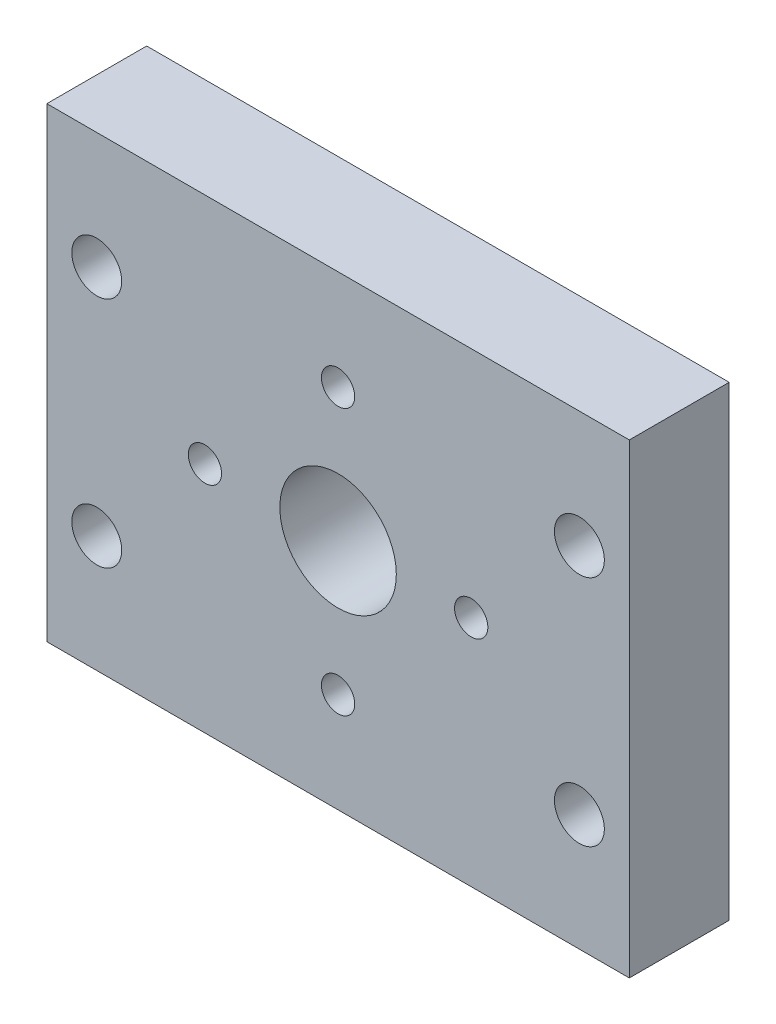
from build123d import *

# Parameters (mm, degrees)
ESQUISSE1_W        = 35
ESQUISSE1_H        = 28
ESQUISSE1_R        = 3.5
ESQUISSE1_R_2      = 1
ESQUISSE1_R_3      = 1.5
BOSS_EXTRU_1_DEPTH = 6


with BuildPart() as part:
    # Esquisse1 → Boss.-Extru.1 (new body)
    with BuildSketch(Plane.XY):
        Rectangle(ESQUISSE1_W, ESQUISSE1_H)
        Circle(ESQUISSE1_R, mode=Mode.SUBTRACT)
        with Locations((0, 8)):
            Circle(ESQUISSE1_R_2, mode=Mode.SUBTRACT)
        with Locations((8, 0)):
            Circle(ESQUISSE1_R_2, mode=Mode.SUBTRACT)
        with Locations((0, -8)):
            Circle(ESQUISSE1_R_2, mode=Mode.SUBTRACT)
        with Locations((-8, 0)):
            Circle(ESQUISSE1_R_2, mode=Mode.SUBTRACT)
        with Locations((-14.5, 7)):
            Circle(ESQUISSE1_R_3, mode=Mode.SUBTRACT)
        with Locations(Location((-14.5, -7, 0), (0, 0, 180))):
            Circle(ESQUISSE1_R_3, mode=Mode.SUBTRACT)
        with Locations((14.5, -7)):
            Circle(ESQUISSE1_R_3, mode=Mode.SUBTRACT)
        with Locations(Location((14.5, 7, 0), (0, 0, 180))):
            Circle(ESQUISSE1_R_3, mode=Mode.SUBTRACT)
    extrude(amount=BOSS_EXTRU_1_DEPTH)


solid = part.part
